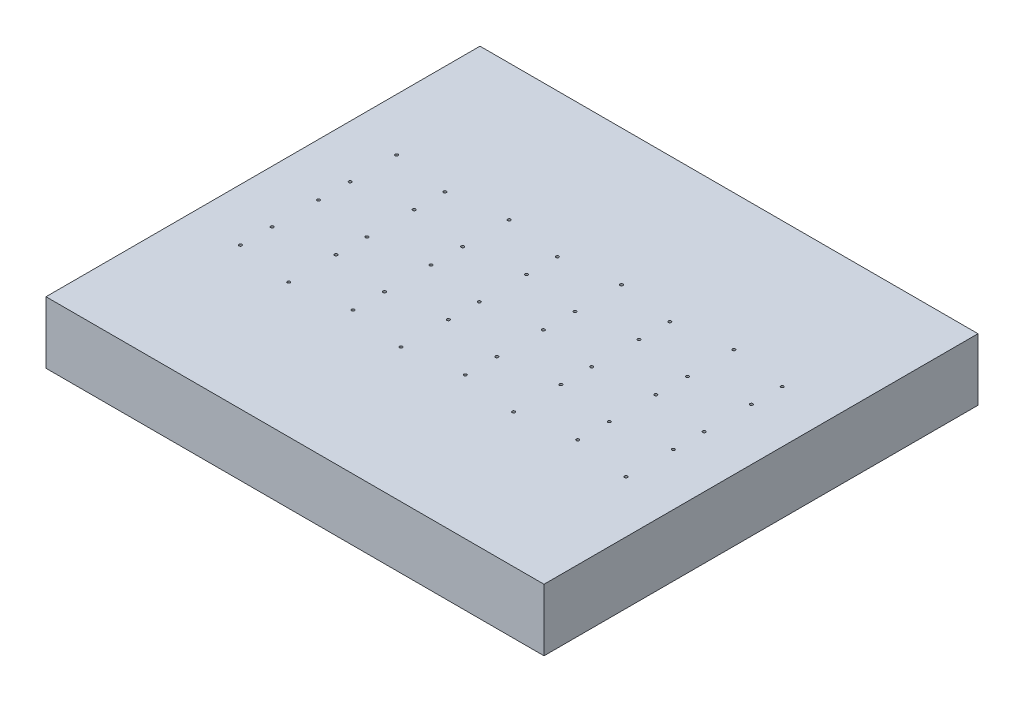
from build123d import *

# Parameters (mm, degrees)
SKETCH1_W           = 306.04968
SKETCH1_H           = 38.1
BOSS_EXTRUDE1_DEPTH = 254
SKETCH4_R           = 0.875
CUT_EXTRUDE3_DEPTH  = 299.97192453
SKETCH5_W           = 306.04968
SKETCH5_H           = 38.1
BOSS_EXTRUDE2_DEPTH = 12.7


with BuildPart() as part:
    # Sketch1 → Boss-Extrude1 (new body)
    with BuildSketch(Plane.XY):
        Rectangle(SKETCH1_W, SKETCH1_H)
    extrude(amount=-BOSS_EXTRUDE1_DEPTH)

    # Sketch4 → Cut-Extrude3 (cut, through all)
    with BuildSketch(Plane(origin=(0, 19.05, 0), x_dir=(1, 0, 0), z_dir=(0, 1, 0))):
        with Locations(Location((-120.750160066, 154.64206771, 0), (0, 0, 270))):
            Circle(SKETCH4_R)
        with Locations(Location((-120.750160066, 183.20793229, 0), (0, 0, 270))):
            Circle(SKETCH4_R)
        with Locations(Location((-120.750160066, 135.20701229, 0), (0, 0, 270))):
            Circle(SKETCH4_R)
        with Locations(Location((-120.750160066, 106.63606771, 0), (0, 0, 270))):
            Circle(SKETCH4_R)
        with Locations(Location((-120.750160066, 87.20609229, 0), (0, 0, 270))):
            Circle(SKETCH4_R)
        with Locations(Location((-86.250160066, 82.391146122, 0), (0, 0, 270))):
            Circle(SKETCH4_R)
        with Locations(Location((-51.662160066, 87.20609229, 0), (0, 0, 270))):
            Circle(SKETCH4_R)
        with Locations(Location((-17.162160066, 82.391146122, 0), (0, 0, 270))):
            Circle(SKETCH4_R)
        with Locations(Location((-51.662160066, 106.63606771, 0), (0, 0, 270))):
            Circle(SKETCH4_R)
        with Locations(Location((-86.250160066, 111.451013878, 0), (0, 0, 270))):
            Circle(SKETCH4_R)
        with Locations(Location((-86.250160066, 130.392066122, 0), (0, 0, 270))):
            Circle(SKETCH4_R)
        with Locations(Location((-86.250160066, 159.457013878, 0), (0, 0, 270))):
            Circle(SKETCH4_R)
        with Locations(Location((-86.250160066, 178.392986122, 0), (0, 0, 270))):
            Circle(SKETCH4_R)
        with Locations(Location((-51.662160066, 183.20793229, 0), (0, 0, 270))):
            Circle(SKETCH4_R)
        with Locations(Location((-51.662160066, 154.64206771, 0), (0, 0, 270))):
            Circle(SKETCH4_R)
        with Locations(Location((-51.662160066, 135.20701229, 0), (0, 0, 270))):
            Circle(SKETCH4_R)
        with Locations(Location((-17.162160066, 178.392986122, 0), (0, 0, 270))):
            Circle(SKETCH4_R)
        with Locations(Location((-17.162160066, 159.457013878, 0), (0, 0, 270))):
            Circle(SKETCH4_R)
        with Locations(Location((-17.162160066, 130.392066122, 0), (0, 0, 270))):
            Circle(SKETCH4_R)
        with Locations(Location((-17.162160066, 111.451013878, 0), (0, 0, 270))):
            Circle(SKETCH4_R)
        with Locations(Location((17.425839934, 87.20609229, 0), (0, 0, 270))):
            Circle(SKETCH4_R)
        with Locations(Location((51.925839934, 82.391146122, 0), (0, 0, 270))):
            Circle(SKETCH4_R)
        with Locations(Location((86.513839934, 87.20609229, 0), (0, 0, 270))):
            Circle(SKETCH4_R)
        with Locations(Location((121.013839934, 82.391146122, 0), (0, 0, 270))):
            Circle(SKETCH4_R)
        with Locations(Location((121.013839934, 111.451013878, 0), (0, 0, 270))):
            Circle(SKETCH4_R)
        with Locations(Location((86.513839934, 106.63606771, 0), (0, 0, 270))):
            Circle(SKETCH4_R)
        with Locations(Location((51.925839934, 111.451013878, 0), (0, 0, 270))):
            Circle(SKETCH4_R)
        with Locations(Location((17.425839934, 106.63606771, 0), (0, 0, 270))):
            Circle(SKETCH4_R)
        with Locations(Location((17.425839934, 154.64206771, 0), (0, 0, 270))):
            Circle(SKETCH4_R)
        with Locations(Location((51.925839934, 159.457013878, 0), (0, 0, 270))):
            Circle(SKETCH4_R)
        with Locations(Location((51.925839934, 130.392066122, 0), (0, 0, 270))):
            Circle(SKETCH4_R)
        with Locations(Location((17.425839934, 135.20701229, 0), (0, 0, 270))):
            Circle(SKETCH4_R)
        with Locations(Location((121.013839934, 130.392066122, 0), (0, 0, 270))):
            Circle(SKETCH4_R)
        with Locations(Location((86.513839934, 154.64206771, 0), (0, 0, 270))):
            Circle(SKETCH4_R)
        with Locations(Location((17.425839934, 183.20793229, 0), (0, 0, 270))):
            Circle(SKETCH4_R)
        with Locations(Location((51.925839934, 178.392986122, 0), (0, 0, 270))):
            Circle(SKETCH4_R)
        with Locations(Location((121.013839934, 159.457013878, 0), (0, 0, 270))):
            Circle(SKETCH4_R)
        with Locations(Location((121.013839934, 178.392986122, 0), (0, 0, 270))):
            Circle(SKETCH4_R)
        with Locations(Location((86.513839934, 135.20701229, 0), (0, 0, 270))):
            Circle(SKETCH4_R)
        with Locations(Location((86.513839934, 183.20793229, 0), (0, 0, 270))):
            Circle(SKETCH4_R)
    extrude(amount=-CUT_EXTRUDE3_DEPTH, mode=Mode.SUBTRACT)

    # Sketch5 → Boss-Extrude2 (add)
    with BuildSketch(Plane(origin=(0, 0, -254), x_dir=(-1, 0, 0), z_dir=(0, 0, -1))):
        Rectangle(SKETCH5_W, SKETCH5_H)
    extrude(amount=BOSS_EXTRUDE2_DEPTH)


solid = part.part
